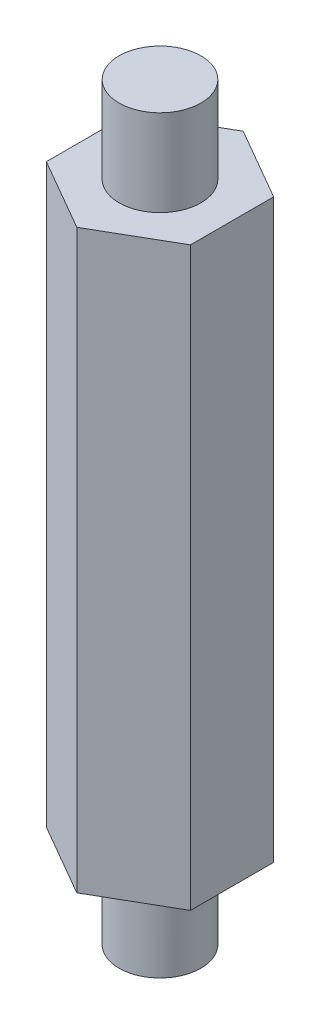
from build123d import *

# Parameters (mm, degrees)
BOSS_EXTRUDE1_DEPTH = 20
SKETCH2_R           = 1.42
BOSS_EXTRUDE2_DEPTH = 3
BOSS_EXTRUDE3_START = 3
SKETCH3_R           = 1.42
BOSS_EXTRUDE3_DEPTH = 3


with BuildPart() as part:
    # Sketch1 → Boss-Extrude1 (new body)
    with BuildSketch(Plane(origin=(0, 0, 0), x_dir=(1, 0, 0), z_dir=(0, 1, 0))):
        Polygon((0, 2.886751346), (-2.5, 1.443375673), (-2.5, -1.443375673), (0, -2.886751346), (2.5, -1.443375673), (2.5, 1.443375673), align=None)
    extrude(amount=BOSS_EXTRUDE1_DEPTH)

    # Sketch2 → Boss-Extrude2 (add)
    with BuildSketch(Plane(origin=(0, 20, 0), x_dir=(1, 0, 0), z_dir=(0, 1, 0))):
        with Locations(Location((0, 0, 0), (0, 0, 270))):
            Circle(SKETCH2_R)
    extrude(amount=BOSS_EXTRUDE2_DEPTH)

    # Sketch3 → Boss-Extrude3 (add)
    with BuildSketch(Plane(origin=(0, 0, 0), x_dir=(-1, 0, 0), z_dir=(0, -1, 0)).offset(BOSS_EXTRUDE3_START)):
        with Locations(Location((0, 0, 0), (0, 0, 270))):
            Circle(SKETCH3_R)
    extrude(amount=-BOSS_EXTRUDE3_DEPTH)


solid = part.part
